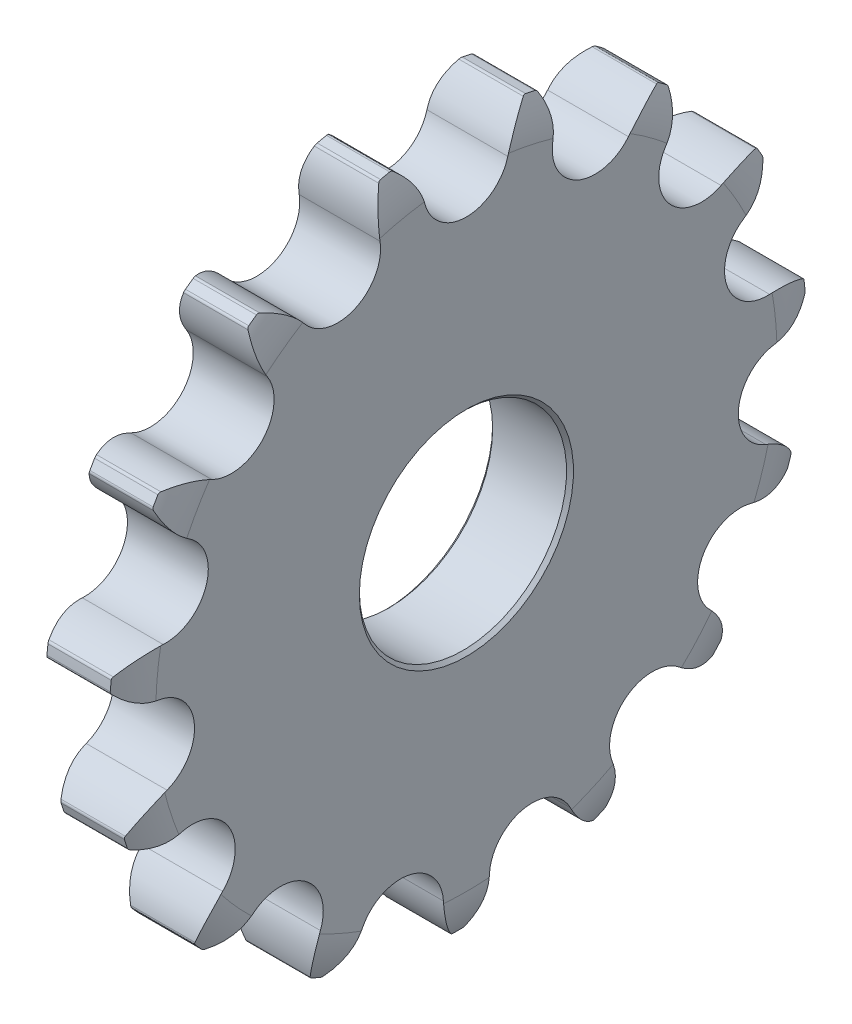
from build123d import *

# Parameters (mm, degrees)
CUT_EXTRUDE_1_DEPTH              = 6
FILLET_1_R                       = 0.5
CHAMFER_1_SIZE                   = 0.5
PATTERN_CIRCULAR_1_COUNT         = 15
FILLET_1_OF_PATTERN_CIRCULAR_1_R = 0.5


with BuildPart() as part:
    # 草圖1 → 旋轉1 (revolve)
    with BuildSketch(Plane.XY, mode=Mode.PRIVATE) as revolve_1_sk:
        with BuildLine():
            Line((-5.85, 15), (5.85, 15))
            Line((5.85, 15), (5.85, 44.964198342))
            ThreePointArc((5.85, 44.964198342), (5.528428818, 47.804004673), (4.58, 50.5))
            Line((4.58, 50.5), (-4.58, 50.5))
            ThreePointArc((-4.58, 50.5), (-5.528428818, 47.804004673), (-5.85, 44.964198342))
            Line((-5.85, 44.964198342), (-5.85, 15))
        make_face()
    revolve(revolve_1_sk.sketch.rotate(Axis((0, 0, 0), (1, 0, 0)), 90), axis=Axis((0, 0, 0), (1, 0, 0)))

    # 草圖2 → 除料-伸長1 (cut, symmetric)
    with BuildSketch(Plane(origin=(0, 0, 0), x_dir=(0, 0, -1), z_dir=(1, 0, 0))):
        with BuildLine():
            ThreePointArc((5.993569954, 44.204028579), (0, 39.605), (-5.993569954, 44.204028579))
            ThreePointArc((-5.993569954, 44.204028579), (-7.351481062, 47.19146683), (-9.603340162, 49.578481801))
            ThreePointArc((-9.603340162, 49.578481801), (0, 50.5), (9.603340162, 49.578481801))
            ThreePointArc((9.603340162, 49.578481801), (7.351481062, 47.19146683), (5.993569954, 44.204028579))
        make_face()
    cut_extrude_1 = extrude(amount=CUT_EXTRUDE_1_DEPTH, both=True, mode=Mode.SUBTRACT)

    # 圓角1
    fillet_1_edges = [part.edges().sort_by_distance(p)[0] for p in [
        (0, 49.578481801, 9.603340162),
        (0, 49.578481801, -9.603340162),
    ]]
    fillet(fillet_1_edges, radius=FILLET_1_R)

    # 導角1
    chamfer_1_edges = [part.edges().sort_by_distance(p)[0] for p in [
        (5.85, 0, -15),
        (-5.85, 0, -15),
    ]]
    chamfer(chamfer_1_edges, length=CHAMFER_1_SIZE)

    # 環狀複製排列1: 除料-伸長1 ×15 about axis
    pattern_circular_1_axis = Axis((0, 0, 0), (1, 0, 0))
    for i in range(1, PATTERN_CIRCULAR_1_COUNT):
        add(cut_extrude_1.rotate(pattern_circular_1_axis, i * 360 / PATTERN_CIRCULAR_1_COUNT), mode=Mode.SUBTRACT)

    # 圓角1 of 環狀複製排列1
    fillet_1_of_pattern_circular_1_edges = [part.edges().sort_by_distance(p)[0] for p in [
        (0, 41.386166507, 28.93847304),
        (0, 49.198227186, 11.392297474),
        (0, 26.037807042, 43.269881031),
        (0, 40.311152139, 30.41810338),
        (0, 6.187274193, 50.119533498),
        (0, 24.453912671, 44.184342873),
        (0, -14.733094573, 48.303063301),
        (0, 4.368369546, 50.31070808),
        (0, -33.105977442, 38.13455464),
        (0, -16.47250436, 47.737894802),
        (0, -45.754536052, 21.37223504),
        (0, -34.465132613, 36.910765827),
        (0, -50.491719713, 0.914461841),
        (0, -46.498426332, 19.701430118),
        (0, -46.498426332, -19.701430118),
        (0, -50.491719713, -0.914461841),
        (0, -34.465132613, -36.910765827),
        (0, -45.754536052, -21.37223504),
        (0, -16.47250436, -47.737894802),
        (0, -33.105977442, -38.13455464),
        (0, 4.368369546, -50.31070808),
        (0, -14.733094573, -48.303063301),
        (0, 24.453912671, -44.184342873),
        (0, 6.187274193, -50.119533498),
        (0, 40.311152139, -30.41810338),
        (0, 26.037807042, -43.269881031),
        (0, 49.198227186, -11.392297474),
        (0, 41.386166507, -28.93847304),
    ]]
    fillet(fillet_1_of_pattern_circular_1_edges, radius=FILLET_1_OF_PATTERN_CIRCULAR_1_R)


solid = part.part
